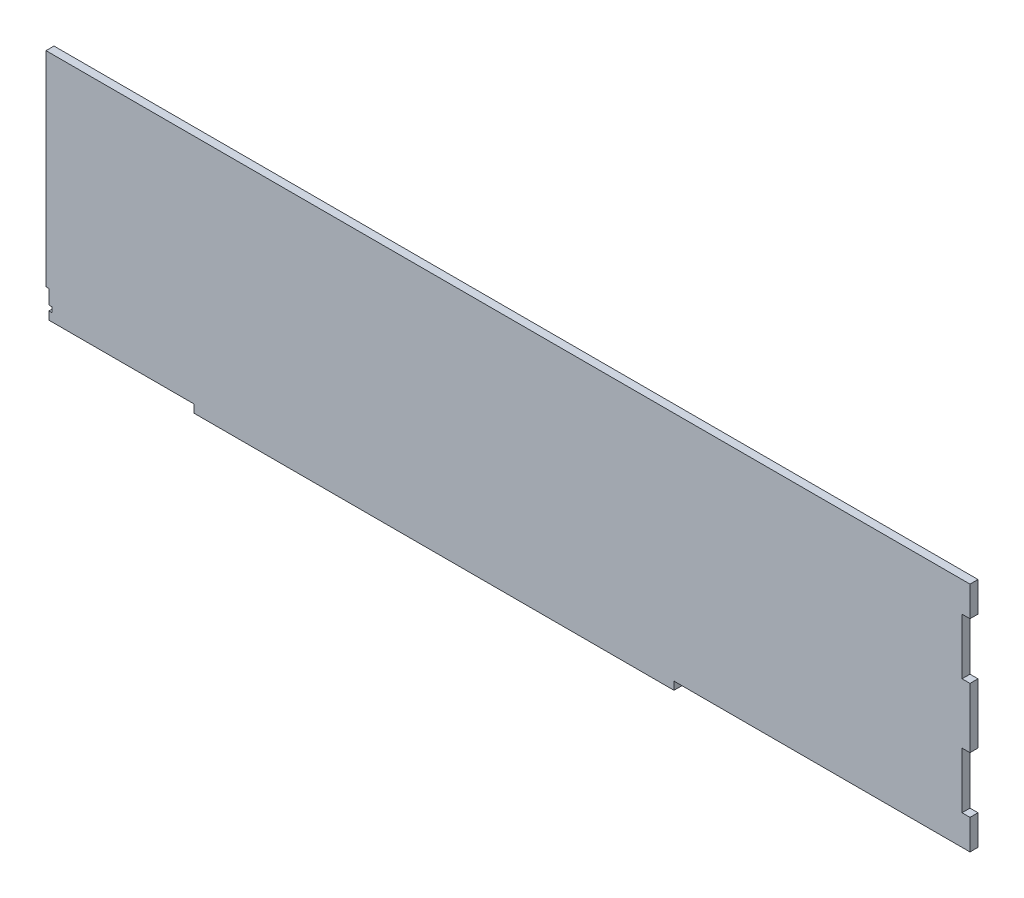
from build123d import *

# Parameters (mm, degrees)
SALIENTE_EXTRUIR1_DEPTH = 5
CROQUIS2_W              = 5
CROQUIS2_H              = 35
CORTAR_EXTRUIR1_DEPTH   = 5
CORTAR_EXTRUIR2_DEPTH   = 10
CORTAR_EXTRUIR5_DEPTH   = 10


with BuildPart() as part:
    # Croquis1 → Saliente-Extruir1 (new body)
    with BuildSketch(Plane.XY):
        Polygon((0, 145), (0, 0), (183.734642654, 0), (185, 0), (185, -5), (485, -5), (485, 0), (670, 0), (670, -5), (970, -5), (970, 0), (1155, 0), (1155, -5), (1455, -5), (1455, 0), (1640, 0), (1640, 145), align=None)
    extrude(amount=SALIENTE_EXTRUIR1_DEPTH)

    # Croquis2 → Cortar-Extruir1 (cut)
    with BuildSketch(Plane.XY.offset(5)):
        with Locations((1637.5, 108.75)):
            Rectangle(CROQUIS2_W, CROQUIS2_H)
        with Locations((1637.5, 36.25)):
            Rectangle(CROQUIS2_W, CROQUIS2_H)
        with Locations((2.5, 36.25)):
            Rectangle(CROQUIS2_W, CROQUIS2_H)
        with Locations((2.5, 108.75)):
            Rectangle(CROQUIS2_W, CROQUIS2_H)
    extrude(amount=-CORTAR_EXTRUIR1_DEPTH, mode=Mode.SUBTRACT)

    # Croquis3 → Cortar-Extruir2 (cut)
    with BuildSketch(Plane.XY.offset(5)):
        Polygon((579.3, 0), (575.7, 0), (575.7, 5), (573.9, 5), (573.9, 8.2), (575.7, 8.2), (575.7, 17.2), (579.3, 17.2), (579.3, 8.2), (581.1, 8.2), (581.1, 5), (579.3, 5), align=None)
        Polygon((1064.3, 8.2), (1064.3, 17.2), (1060.7, 17.2), (1060.7, 8.2), (1058.9, 8.2), (1058.9, 5), (1060.7, 5), (1060.7, 0), (1064.3, 0), (1064.3, 5), (1066.1, 5), (1066.1, 8.2), align=None)
    extrude(amount=-CORTAR_EXTRUIR2_DEPTH, mode=Mode.SUBTRACT)

    # Croquis4 → Cortar-Extruir5 (cut)
    with BuildSketch(Plane.XY.offset(5)):
        Polygon((1062.5, 17.2), (1062.5, 145), (0, 145), (0, -10.556117746), (1062.5, -10.556117746), align=None)
    extrude(amount=-CORTAR_EXTRUIR5_DEPTH, mode=Mode.SUBTRACT)


solid = part.part
